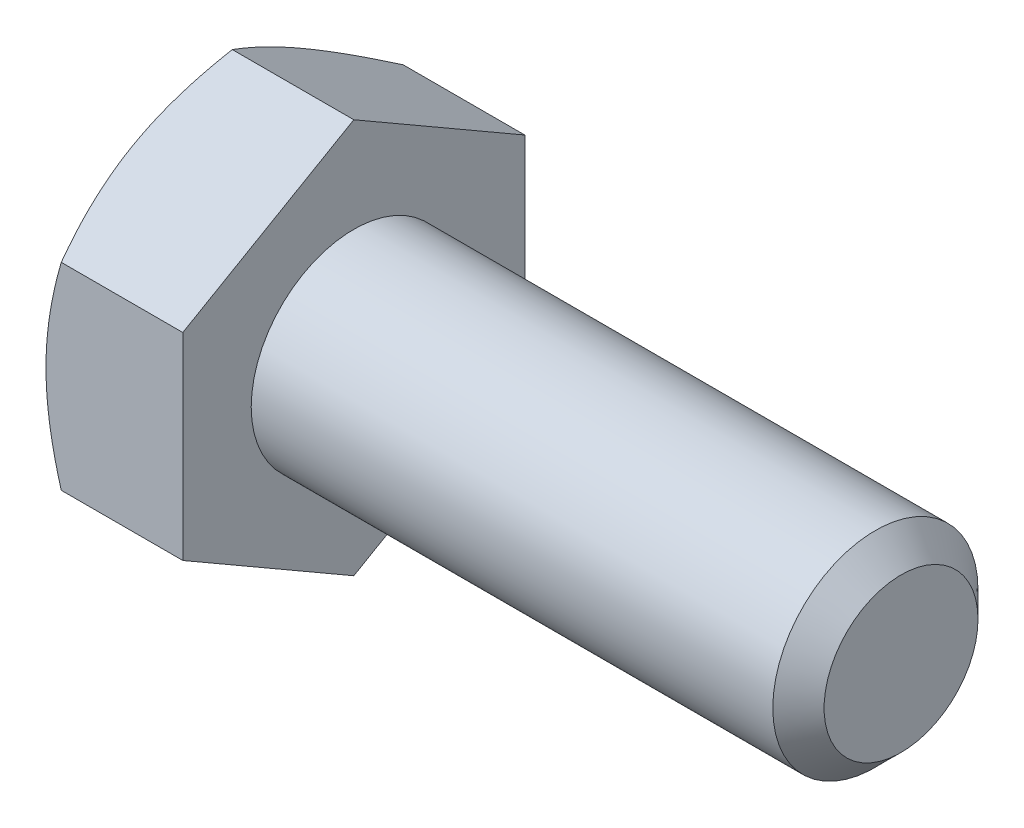
from build123d import *

# Parameters (mm, degrees)
SKETCH2_R           = 3
BOSS_EXTRUDE1_DEPTH = 16
CHAMFER1_SIZE       = 0.75
BOSS_EXTRUDE2_DEPTH = 4
SKETCH6_OUTSIDE_W   = 94.66
SKETCH6_OUTSIDE_H   = 96.208
SKETCH6_OUTSIDE_R   = 5
CUT_EXTRUDE1_DEPTH  = 22.408720964
CUT_EXTRUDE1_DRAFT  = -60


with BuildPart() as part:
    # Sketch2 → Boss-Extrude1 (new body)
    with BuildSketch(Plane(origin=(10, 0, 0), x_dir=(0, 0, -1), z_dir=(1, 0, 0))):
        Circle(SKETCH2_R)
    extrude(amount=-BOSS_EXTRUDE1_DEPTH)

    # Chamfer1
    chamfer1_edges = [part.edges().sort_by_distance(p)[0] for p in [
        (10, 0, 3),
    ]]
    chamfer(chamfer1_edges, length=CHAMFER1_SIZE)

    # Sketch3 → Boss-Extrude2 (add)
    with BuildSketch(Plane.ZY.offset(6)):
        Polygon((-5, -2.886751346), (0, -5.773502692), (5, -2.886751346), (5, 2.886751346), (0, 5.773502692), (-5, 2.886751346), align=None)
    extrude(amount=BOSS_EXTRUDE2_DEPTH)


with BuildPart() as cut_extrude1_tool:
    # Sketch6 outside → Cut-Extrude1 (with draft: the straight prism first)
    with BuildSketch(Plane.ZY.offset(10)):
        Rectangle(SKETCH6_OUTSIDE_W, SKETCH6_OUTSIDE_H)
        Circle(SKETCH6_OUTSIDE_R, mode=Mode.SUBTRACT)
    extrude(amount=-CUT_EXTRUDE1_DEPTH)
    # Cut-Extrude1: the draft: its side faces are tilted about the plane it starts from
    cut_extrude1_sides = [cut_extrude1_tool.faces().sort_by_distance(p)[0] for p in [
        (1.204360482, -48.104, 0),
        (1.204360482, 0, 47.33),
        (1.204360482, 48.104, 0),
        (1.204360482, 0, -47.33),
        (1.204360482, 0, -5),
    ]]
    draft(cut_extrude1_sides, Plane.ZY.offset(10), CUT_EXTRUDE1_DRAFT)


with BuildPart() as part_1:
    add(part.part)

    # Cut-Extrude1: cut by cut_extrude1_tool
    add(cut_extrude1_tool.part, mode=Mode.SUBTRACT)


solid = part_1.part
